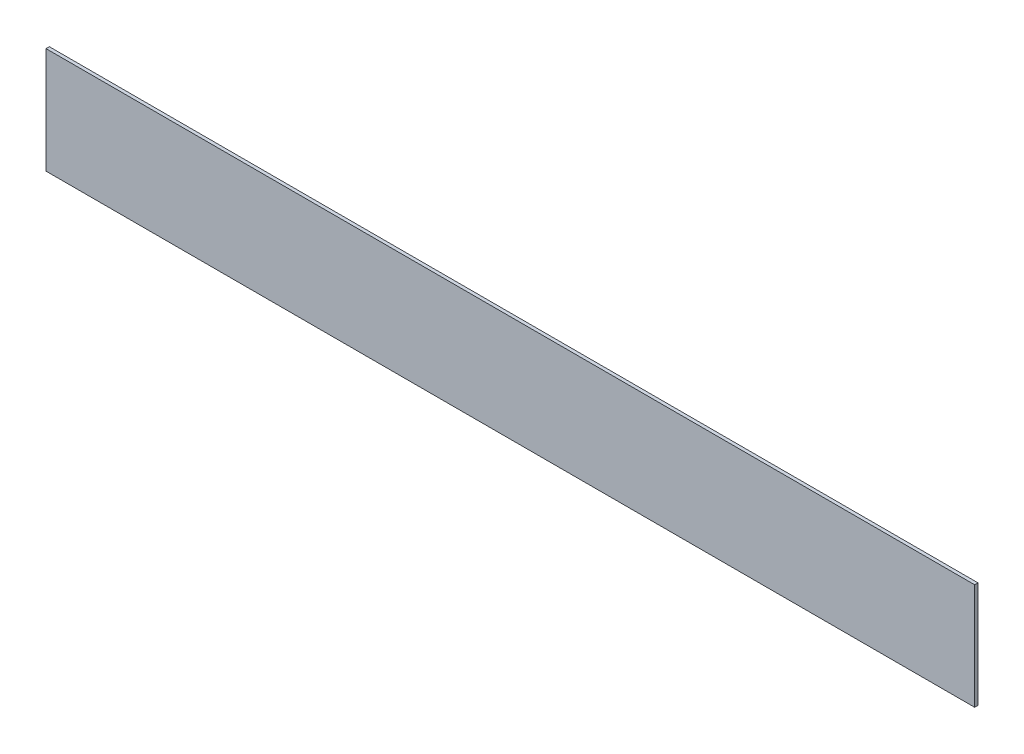
from build123d import *

# Parameters (mm, degrees)
SKETCH1_W           = 444.5
SKETCH1_H           = 50.8
BOSS_EXTRUDE1_DEPTH = 1.5875


with BuildPart() as part:
    # Sketch1 → Boss-Extrude1 (new body)
    with BuildSketch(Plane.XY):
        with Locations((-222.25, -25.4)):
            Rectangle(SKETCH1_W, SKETCH1_H)
    extrude(amount=BOSS_EXTRUDE1_DEPTH)


solid = part.part
